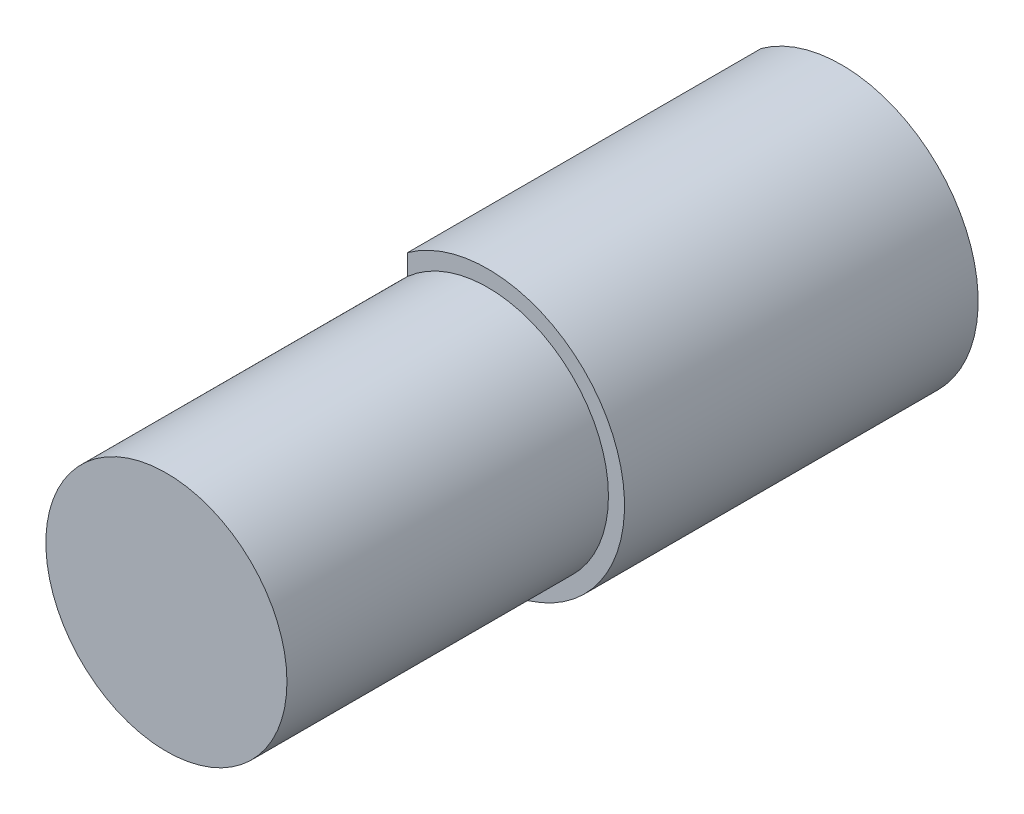
from build123d import *
from build123d.topology import SkipClean

# Parameters (mm, degrees)
BOSS_EXTRUDE1_DEPTH = 10
SKETCH2_R           = 4.25
BOSS_EXTRUDE2_DEPTH = 20
BOSS_EXTRUDE3_START = 1
BOSS_EXTRUDE3_DEPTH = 1
CUT_EXTRUDE1_START  = -20
SKETCH5_R           = 4.25
SKETCH5_R_2         = 3.75
CUT_EXTRUDE1_DEPTH  = 20
CUT_EXTRUDE2_START  = -10
SKETCH6_R           = 3.75
CUT_EXTRUDE2_DEPTH  = 10


with BuildPart() as part:
    # Sketch1 → Boss-Extrude1 (new body)
    with BuildSketch(Plane.XY):
        with BuildLine():
            Line((-2.5, 3.436931771), (-2.5, -3.436931771))
            ThreePointArc((-2.5, -3.436931771), (4.25, 0), (-2.5, 3.436931771))
        make_face()
    extrude(amount=BOSS_EXTRUDE1_DEPTH)

    # Sketch2 → Boss-Extrude2 (add)
    with BuildSketch(Plane.XY.offset(10)):
        with Locations(Location((0, 0, 0), (0, 0, 126.031879072))):
            Circle(SKETCH2_R)
    extrude(amount=BOSS_EXTRUDE2_DEPTH)

    # Sketch3 → Boss-Extrude3 (add)
    with SkipClean():  # the faces are left unmerged after this step: merging them gives an invalid solid
        with BuildSketch(Plane(origin=(0, 0, 0), x_dir=(-1, 0, 0), z_dir=(0, 0, -1)).offset(BOSS_EXTRUDE3_START)):
            with BuildLine():
                Line((2.5, -3.436931771), (2.5, 3.436931771))
                ThreePointArc((2.5, 3.436931771), (-4.25, 0), (2.5, -3.436931771))
            make_face()
        extrude(amount=-BOSS_EXTRUDE3_DEPTH)

    # Sketch5 → Cut-Extrude1 (cut)
    with SkipClean():  # the faces are left unmerged after this step: merging them gives an invalid solid
        with BuildSketch(Plane.XY.offset(30).offset(CUT_EXTRUDE1_START)):
            Circle(SKETCH5_R)
            Circle(SKETCH5_R_2, mode=Mode.SUBTRACT)
        extrude(amount=CUT_EXTRUDE1_DEPTH, mode=Mode.SUBTRACT)

    # Sketch6 → Cut-Extrude2 (cut)
    with SkipClean():  # the faces are left unmerged after this step: merging them gives an invalid solid
        with BuildSketch(Plane.XY.offset(30).offset(CUT_EXTRUDE2_START)):
            Circle(SKETCH6_R)
        extrude(amount=CUT_EXTRUDE2_DEPTH, mode=Mode.SUBTRACT)


solid = part.part
